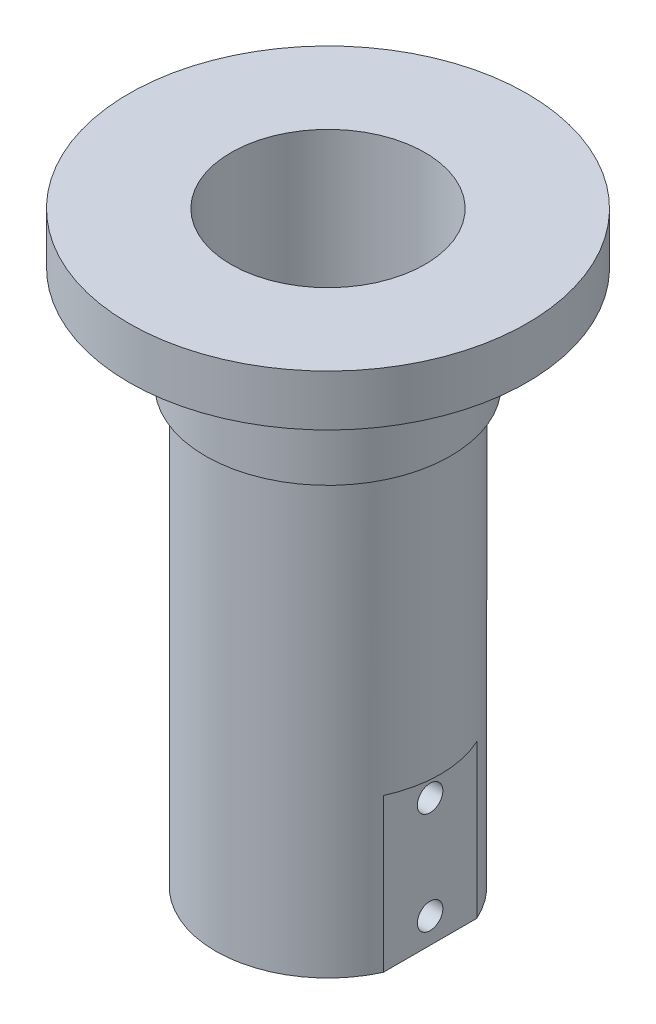
from build123d import *

# Parameters (mm, degrees)
M3_TAPPED_HOLE1_D     = 2.5
M3_TAPPED_HOLE1_DEPTH = 7.5
M3_TAPPED_HOLE1_TIP   = 0.751075774
SKETCH4_OUTSIDE_W     = 111.87
SKETCH4_OUTSIDE_H     = 111.87
SKETCH4_OUTSIDE_W_2   = 40
SKETCH4_OUTSIDE_H_2   = 58.988764044
EXTRUDE1_DEPTH        = 30
M6_TAPPED_HOLE1_D     = 5


with BuildPart() as part:
    # Sketch1 → Revolve1 (revolve)
    with BuildSketch(Plane.XY, mode=Mode.PRIVATE) as revolve1_sk:
        Polygon((19, 66.959459459), (39, 66.959459459), (39, 56.959459459), (24, 56.959459459), (24, 36.959459459), (22, 36.959459459), (22, -48.040540541), (12.5, -48.040540541), (12.5, -41.040540541), (10.5, -41.040540541), (10.5, -34.040540541), (8.5, -34.040540541), (8.5, -14.040540541), (19, -14.040540541), align=None)
    revolve(revolve1_sk.sketch.rotate(Axis((0, 66.959459459, 0), (0, -1, 0)), 90), axis=Axis((0, 66.959459459, 0), (0, -1, 0)))

    # M3 Tapped Hole1
    with Locations(Plane(origin=(-11, -48.040540541, 11), x_dir=(0, 0, -1), z_dir=(0, -1, 0))):
        with Locations((0, 0), (0, 22), (22, 0), (22, 22)):
            Hole(M3_TAPPED_HOLE1_D / 2, depth=M3_TAPPED_HOLE1_DEPTH)
            with Locations((0, 0, -(M3_TAPPED_HOLE1_DEPTH + M3_TAPPED_HOLE1_TIP / 2))):  # 118° drill point
                Cone(0, M3_TAPPED_HOLE1_D / 2, M3_TAPPED_HOLE1_TIP, mode=Mode.SUBTRACT)

    # Sketch4 outside → Extrude1 (cut)
    with BuildSketch(Plane.XZ.offset(48.040540541)):
        Rectangle(SKETCH4_OUTSIDE_W, SKETCH4_OUTSIDE_H)
        Rectangle(SKETCH4_OUTSIDE_W_2, SKETCH4_OUTSIDE_H_2, mode=Mode.SUBTRACT)
    extrude(amount=-EXTRUDE1_DEPTH, mode=Mode.SUBTRACT)

    # M6 Tapped Hole1 (through all)
    with Locations(Plane(origin=(-20, -23.040540541, 0), x_dir=(0, 0, -1), z_dir=(-1, 0, 0))):
        with Locations((0, 0), (0, 20)):
            Hole(M6_TAPPED_HOLE1_D / 2)


solid = part.part
